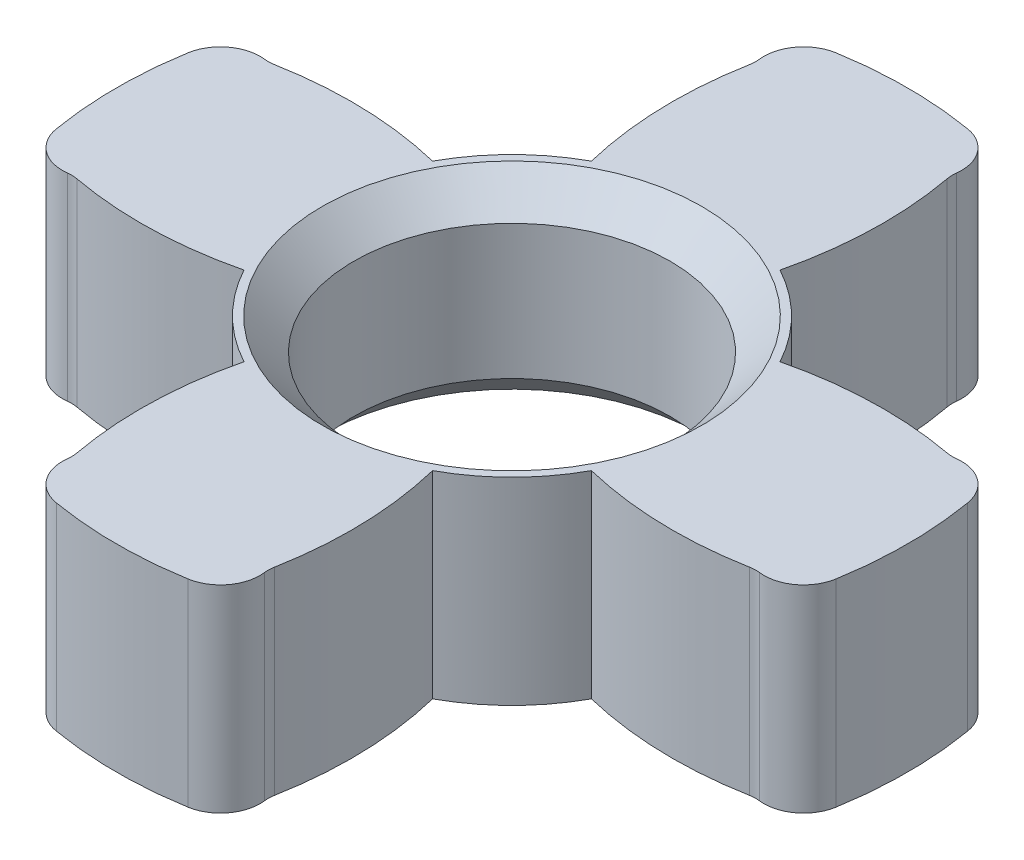
from build123d import *

# Parameters (mm, degrees)
EXTRUDE_1_DEPTH     = 2.5
SKETCH_4_R          = 4
CUT_EXTRUDE_1_DEPTH = 6
CHAMFER_1_SIZE      = 0.8
CHAMFER_2_SIZE      = 0.8


with BuildPart() as part:
    # 草图1 → 凸台-拉伸1 (new, symmetric)
    with BuildSketch(Plane(origin=(0, 0, 0), x_dir=(1, 0, 0), z_dir=(0, 1, 0))):
        with BuildLine():
            ThreePointArc((-9.860132972, 1.666666667), (-10, 0), (-9.860132972, -1.666666667))
            ThreePointArc((-9.860132972, -1.666666667), (-9.471702803, -2.301806962), (-8.752043547, -2.49252074))
            ThreePointArc((-8.752043547, -2.49252074), (-8.629852726, -2.486913493), (-8.50823537, -2.5))
            ThreePointArc((-8.50823537, -2.5), (-6.445172036, -2.661121156), (-4.394270374, -2.385453391))
            ThreePointArc((-4.394270374, -2.385453391), (-3.535533906, -3.535533906), (-2.385453391, -4.394270374))
            ThreePointArc((-2.385453391, -4.394270374), (-2.661121156, -6.445172036), (-2.5, -8.50823537))
            ThreePointArc((-2.5, -8.50823537), (-2.486913493, -8.629852726), (-2.49252074, -8.752043547))
            ThreePointArc((-2.49252074, -8.752043547), (-2.301806962, -9.471702803), (-1.666666667, -9.860132972))
            ThreePointArc((-1.666666667, -9.860132972), (0, -10), (1.666666667, -9.860132972))
            ThreePointArc((1.666666667, -9.860132972), (2.301806962, -9.471702803), (2.49252074, -8.752043547))
            ThreePointArc((2.49252074, -8.752043547), (2.486913493, -8.629852726), (2.5, -8.50823537))
            ThreePointArc((2.5, -8.50823537), (2.661121156, -6.445172036), (2.385453391, -4.394270374))
            ThreePointArc((2.385453391, -4.394270374), (3.535533906, -3.535533906), (4.394270374, -2.385453391))
            ThreePointArc((4.394270374, -2.385453391), (6.445172036, -2.661121156), (8.50823537, -2.5))
            ThreePointArc((8.50823537, -2.5), (8.629852726, -2.486913493), (8.752043547, -2.49252074))
            ThreePointArc((8.752043547, -2.49252074), (9.471702803, -2.301806962), (9.860132972, -1.666666667))
            ThreePointArc((9.860132972, -1.666666667), (10, 0), (9.860132972, 1.666666667))
            ThreePointArc((9.860132972, 1.666666667), (9.471702803, 2.301806962), (8.752043547, 2.49252074))
            ThreePointArc((8.752043547, 2.49252074), (8.629852726, 2.486913493), (8.50823537, 2.5))
            ThreePointArc((8.50823537, 2.5), (6.445172036, 2.661121156), (4.394270374, 2.385453391))
            ThreePointArc((4.394270374, 2.385453391), (3.535533906, 3.535533906), (2.385453391, 4.394270374))
            ThreePointArc((2.385453391, 4.394270374), (2.661121156, 6.445172036), (2.5, 8.50823537))
            ThreePointArc((2.5, 8.50823537), (2.486913493, 8.629852726), (2.49252074, 8.752043547))
            ThreePointArc((2.49252074, 8.752043547), (2.301806962, 9.471702803), (1.666666667, 9.860132972))
            ThreePointArc((1.666666667, 9.860132972), (0, 10), (-1.666666667, 9.860132972))
            ThreePointArc((-1.666666667, 9.860132972), (-2.301806962, 9.471702803), (-2.49252074, 8.752043547))
            ThreePointArc((-2.49252074, 8.752043547), (-2.486913493, 8.629852726), (-2.5, 8.50823537))
            ThreePointArc((-2.5, 8.50823537), (-2.661121156, 6.445172036), (-2.385453391, 4.394270374))
            ThreePointArc((-2.385453391, 4.394270374), (-3.535533906, 3.535533906), (-4.394270374, 2.385453391))
            ThreePointArc((-4.394270374, 2.385453391), (-6.445172036, 2.661121156), (-8.50823537, 2.5))
            ThreePointArc((-8.50823537, 2.5), (-8.629852726, 2.486913493), (-8.752043547, 2.49252074))
            ThreePointArc((-8.752043547, 2.49252074), (-9.471702803, 2.301806962), (-9.860132972, 1.666666667))
        make_face()
    extrude(amount=EXTRUDE_1_DEPTH, both=True)

    # 草图4 → 切除-拉伸1 (cut, symmetric)
    with BuildSketch(Plane(origin=(0, 2.5, 0), x_dir=(1, 0, 0), z_dir=(0, 1, 0))):
        with Locations(Location((0, 0, 0), (0, 0, 90))):
            Circle(SKETCH_4_R)
    extrude(amount=CUT_EXTRUDE_1_DEPTH, both=True, mode=Mode.SUBTRACT)

    # 倒角1
    chamfer_1_edges = [part.edges().sort_by_distance(p)[0] for p in [
        (0, 2.5, 4),
    ]]
    chamfer(chamfer_1_edges, length=CHAMFER_1_SIZE)

    # 倒角2
    chamfer_2_edges = [part.edges().sort_by_distance(p)[0] for p in [
        (0, -2.5, 4),
    ]]
    chamfer(chamfer_2_edges, length=CHAMFER_2_SIZE)


solid = part.part
